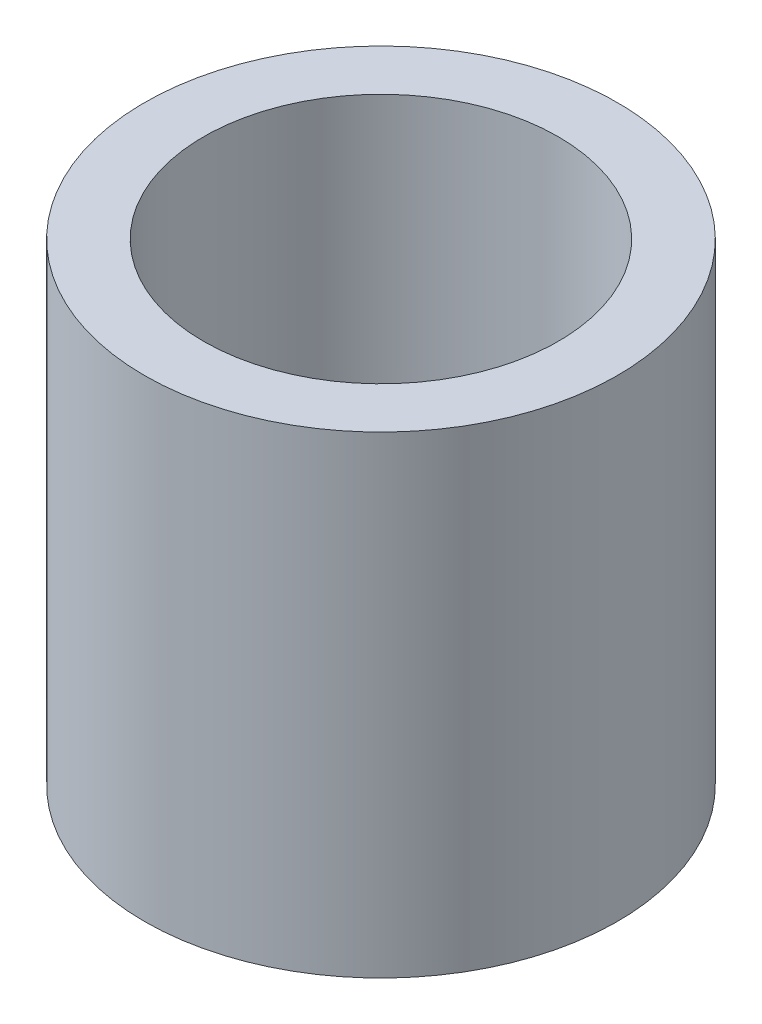
from build123d import *

# Parameters (mm, degrees)
SKETCH1_R           = 2
SKETCH1_R_2         = 1.5
BOSS_EXTRUDE1_DEPTH = 2


with BuildPart() as part:
    # Sketch1 → Boss-Extrude1 (new, symmetric)
    with BuildSketch(Plane(origin=(0, 0, 0), x_dir=(1, 0, 0), z_dir=(0, 1, 0))):
        with Locations(Location((0, 0, 0), (0, 0, 270))):
            Circle(SKETCH1_R)
        with Locations(Location((0, 0, 0), (0, 0, 270))):
            Circle(SKETCH1_R_2, mode=Mode.SUBTRACT)
    extrude(amount=BOSS_EXTRUDE1_DEPTH, both=True)


solid = part.part
